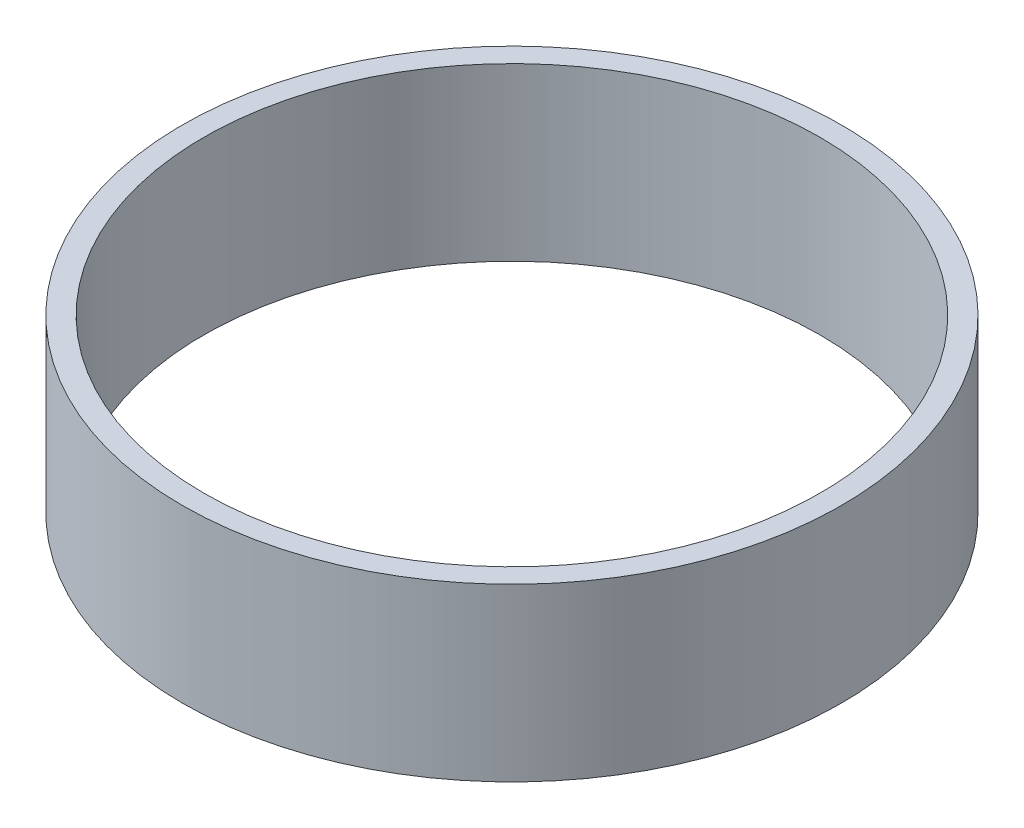
from build123d import *

# Parameters (mm, degrees)
SKETCH1_R           = 23.1
SKETCH1_R_2         = 21.6
BOSS_EXTRUDE1_DEPTH = 12


with BuildPart() as part:
    # Sketch1 → Boss-Extrude1 (new body)
    with BuildSketch(Plane(origin=(0, 0, 0), x_dir=(1, 0, 0), z_dir=(0, 1, 0))):
        with Locations(Location((1.414889331, 0.59772979, 0), (0, 0, 270))):
            Circle(SKETCH1_R)
        with Locations(Location((1.414889331, 0.59772979, 0), (0, 0, 270))):
            Circle(SKETCH1_R_2, mode=Mode.SUBTRACT)
    extrude(amount=BOSS_EXTRUDE1_DEPTH)


solid = part.part
